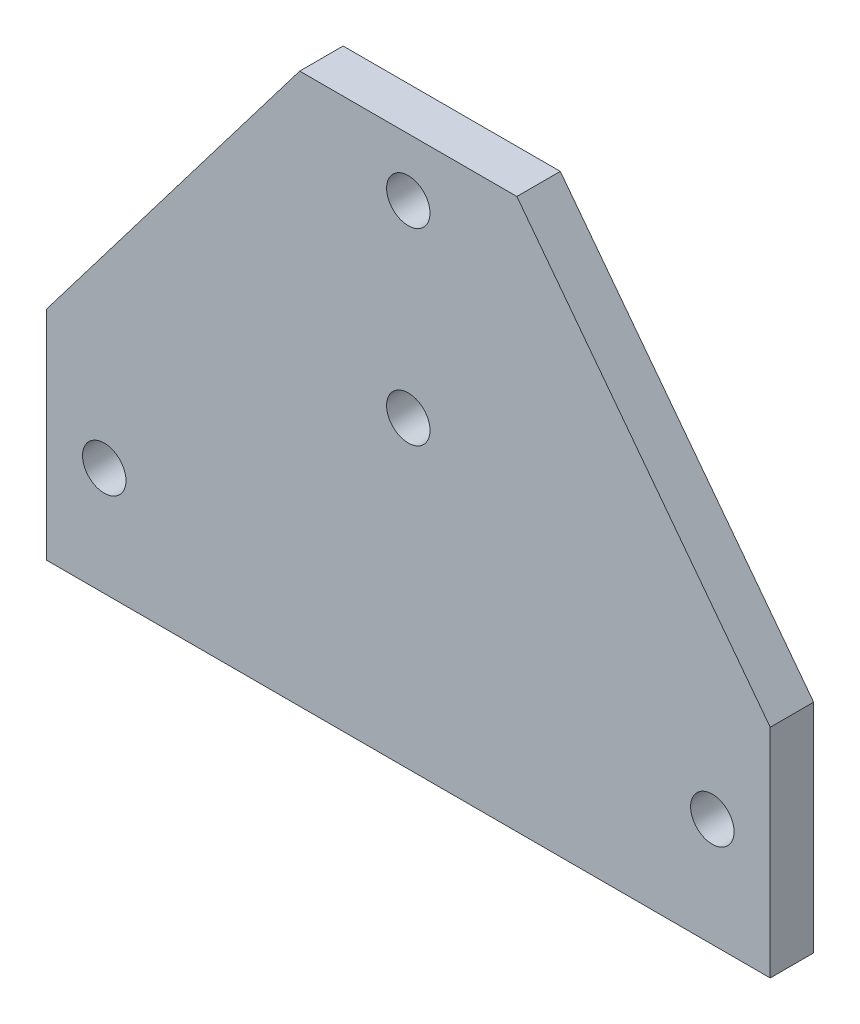
from build123d import *

# Parameters (mm, degrees)
EXTRUDE_1_DEPTH     = 3
SKETCH_2_R          = 1.5
CUT_EXTRUDE_1_DEPTH = 3


with BuildPart() as part:
    # 草图1 → 凸台-拉伸1 (new body)
    with BuildSketch(Plane.XY):
        Polygon((0, 0), (15, 0), (32.5, -23), (32.5, -38), (-17.5, -38), (-17.5, -23), align=None)
    extrude(amount=EXTRUDE_1_DEPTH)

    # 草图2 → 切除-拉伸1 (cut)
    with BuildSketch(Plane.XY.offset(3)):
        with Locations((7.5, -4)):
            Circle(SKETCH_2_R)
        with Locations((7.5, -17)):
            Circle(SKETCH_2_R)
        with Locations((28.5, -30.5)):
            Circle(SKETCH_2_R)
        with Locations((-13.5, -30.5)):
            Circle(SKETCH_2_R)
    extrude(amount=-CUT_EXTRUDE_1_DEPTH, mode=Mode.SUBTRACT)


solid = part.part
